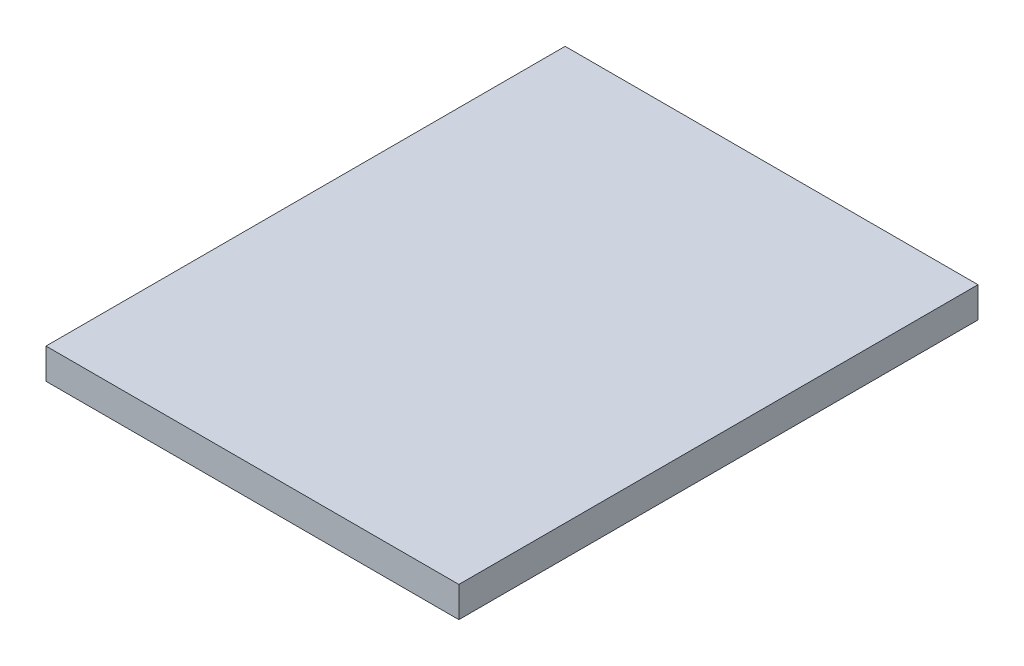
from build123d import *

# Parameters (mm, degrees)
SKETCH1_W           = 85.852
SKETCH1_H           = 107.95
BOSS_EXTRUDE1_DEPTH = 6.35


with BuildPart() as part:
    # Sketch1 → Boss-Extrude1 (new body)
    with BuildSketch(Plane(origin=(0, 0, 0), x_dir=(1, 0, 0), z_dir=(0, 1, 0))):
        Rectangle(SKETCH1_W, SKETCH1_H)
    extrude(amount=BOSS_EXTRUDE1_DEPTH)


solid = part.part
